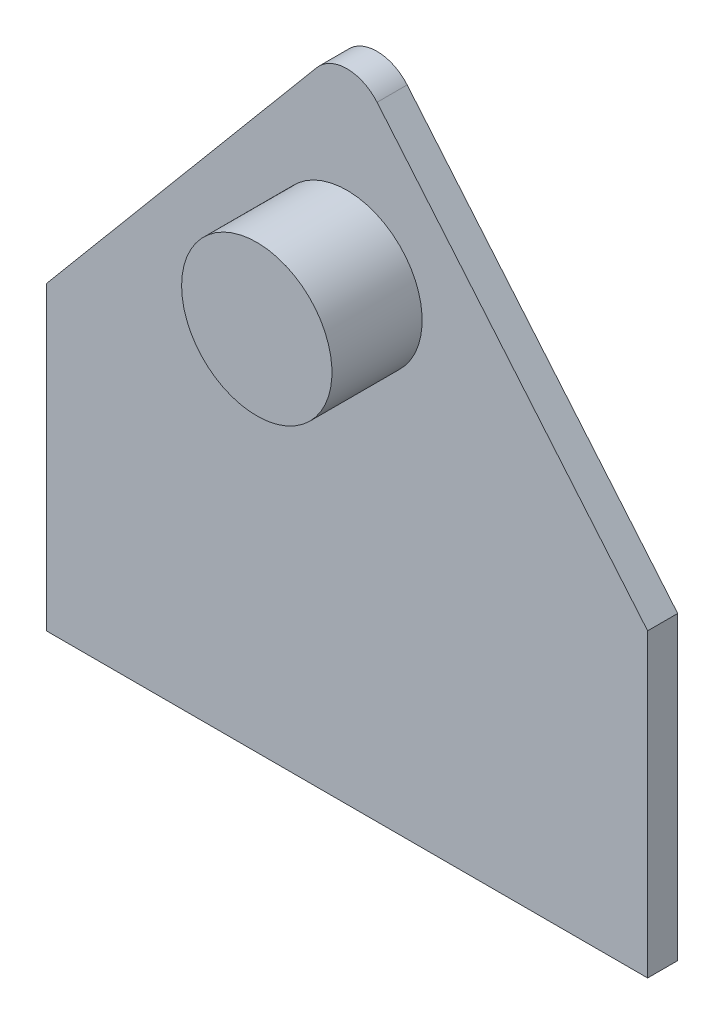
from build123d import *

# Parameters (mm, degrees)
BOSS_EXTRUDE2_DEPTH = 1.27
SKETCH2_R           = 3.175
BOSS_EXTRUDE4_DEPTH = 3.81


with BuildPart() as part:
    # Sketch1 → Boss-Extrude2 (new body)
    with BuildSketch(Plane.XY):
        with BuildLine():
            Line((-10.19943336, 0), (-10.19943336, 12.7))
            Line((-10.19943336, 12.7), (1.22933034, 26.320270199))
            ThreePointArc((1.22933034, 26.320270199), (2.50056664, 26.913057421), (3.77180294, 26.320270199))
            Line((3.77180294, 26.320270199), (15.20056664, 12.7))
            Line((15.20056664, 12.7), (15.20056664, 0))
            Line((15.20056664, 0), (-10.19943336, 0))
        make_face()
    extrude(amount=BOSS_EXTRUDE2_DEPTH)

    # Sketch2 → Boss-Extrude4 (add)
    with BuildSketch(Plane.XY.offset(1.27)):
        with Locations(Location((2.50056664, 19.293057421, 0), (0, 0, 180))):
            Circle(SKETCH2_R)
    extrude(amount=BOSS_EXTRUDE4_DEPTH)


solid = part.part
